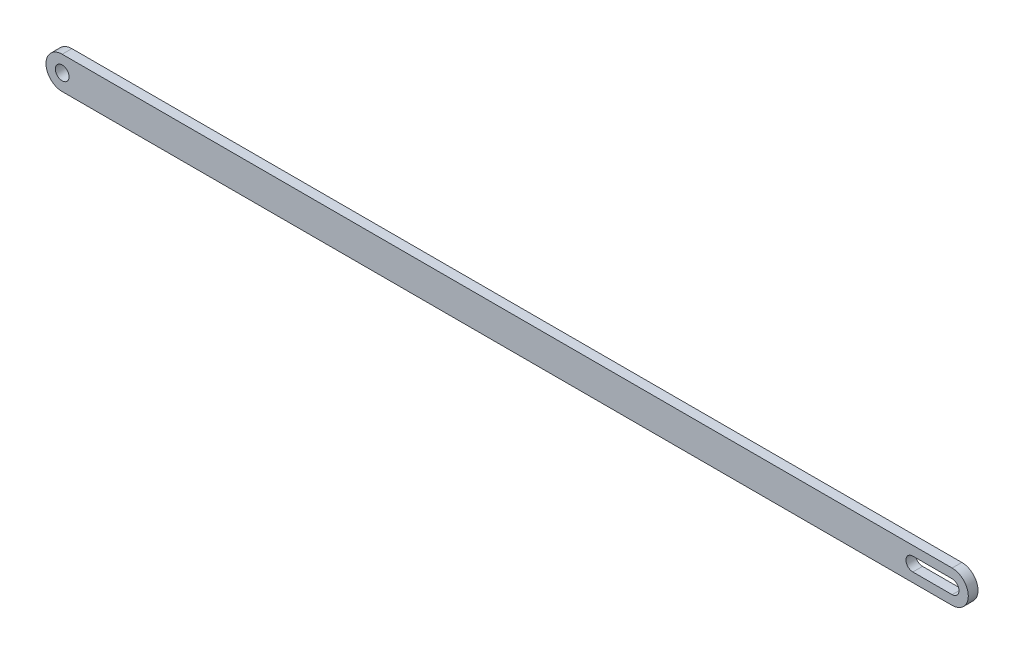
from build123d import *

# Parameters (mm, degrees)
SKETCH_1_R      = 1.7
EXTRUDE_1_DEPTH = 2.4


with BuildPart() as part:
    # 草图1 → 凸台-拉伸1 (new body)
    with BuildSketch(Plane.XY):
        with BuildLine():
            Line((-53.850242828, -4), (166.149757172, -4))
            ThreePointArc((166.149757172, -4), (170.149757172, 0), (166.149757172, 4))
            Line((166.149757172, 4), (-53.850242828, 4))
            ThreePointArc((-53.850242828, 4), (-57.850242828, 0), (-53.850242828, -4))
        make_face()
        with Locations((-53.850242828, 0)):
            Circle(SKETCH_1_R, mode=Mode.SUBTRACT)
        with BuildLine():
            ThreePointArc((156.438691487, 1.7), (154.738691487, 0), (156.438691487, -1.7))
            Line((156.438691487, -1.7), (166.149757172, -1.7))
            ThreePointArc((166.149757172, -1.7), (167.849757172, 0), (166.149757172, 1.7))
            Line((166.149757172, 1.7), (156.438691487, 1.7))
        make_face(mode=Mode.SUBTRACT)
    extrude(amount=EXTRUDE_1_DEPTH)


solid = part.part
